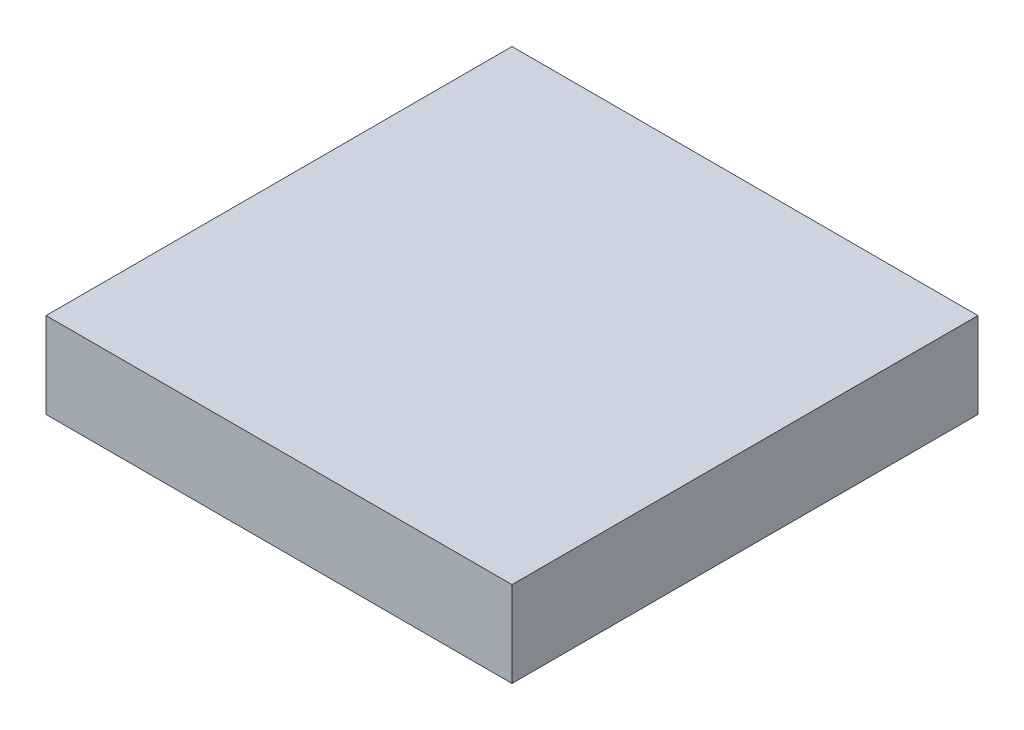
from build123d import *

# Parameters (mm, degrees)
SKETCH_1_W      = 15.24
SKETCH_1_H      = 15.24
EXTRUDE_1_DEPTH = 2.8


with BuildPart() as part:
    # 草图1 → 凸台-拉伸1 (new body)
    with BuildSketch(Plane(origin=(0, 0, 0), x_dir=(1, 0, 0), z_dir=(0, 1, 0))):
        Rectangle(SKETCH_1_W, SKETCH_1_H)
    extrude(amount=EXTRUDE_1_DEPTH)


solid = part.part
